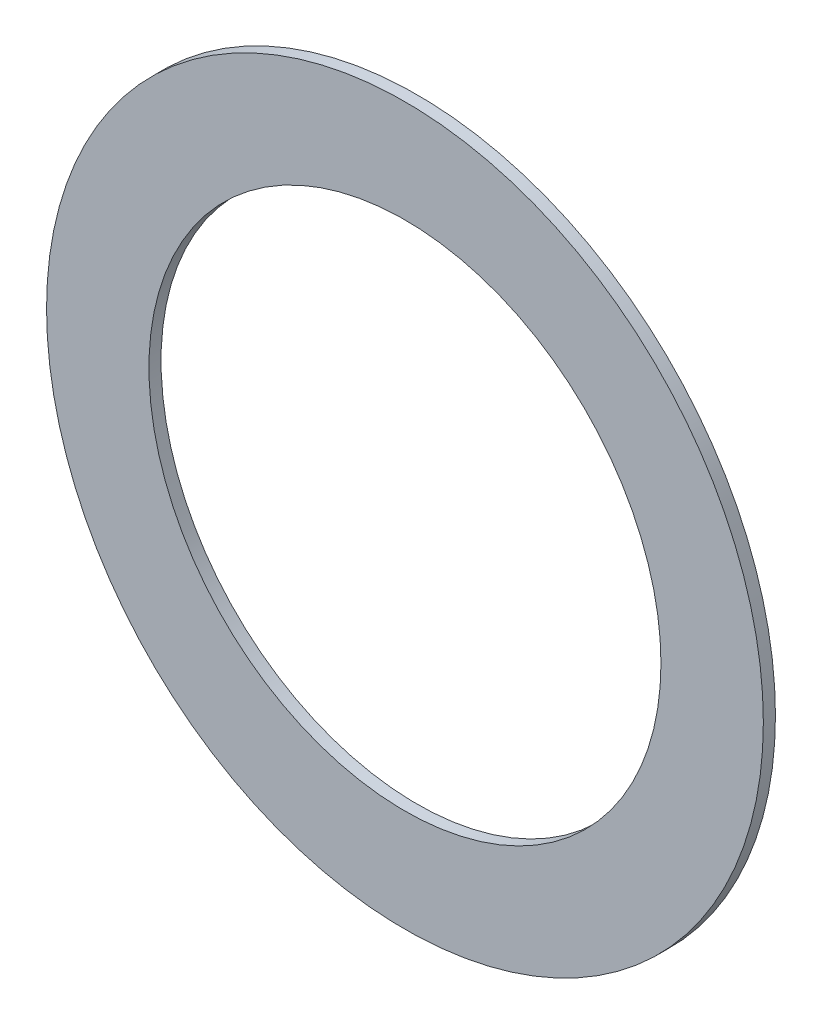
from build123d import *

# Parameters (mm, degrees)
SKETCH1_R           = 88.9
SKETCH1_R_2         = 63.5
BOSS_EXTRUDE1_DEPTH = 3


with BuildPart() as part:
    # Sketch1 → Boss-Extrude1 (new body)
    with BuildSketch(Plane(origin=(0, 0, 0), x_dir=(0, 1, 0), z_dir=(0, 0, 1))):
        with Locations(Location((0, 0, 0), (0, 0, 270))):
            Circle(SKETCH1_R)
        with Locations(Location((0, 0, 0), (0, 0, 270))):
            Circle(SKETCH1_R_2, mode=Mode.SUBTRACT)
    extrude(amount=BOSS_EXTRUDE1_DEPTH)


solid = part.part
